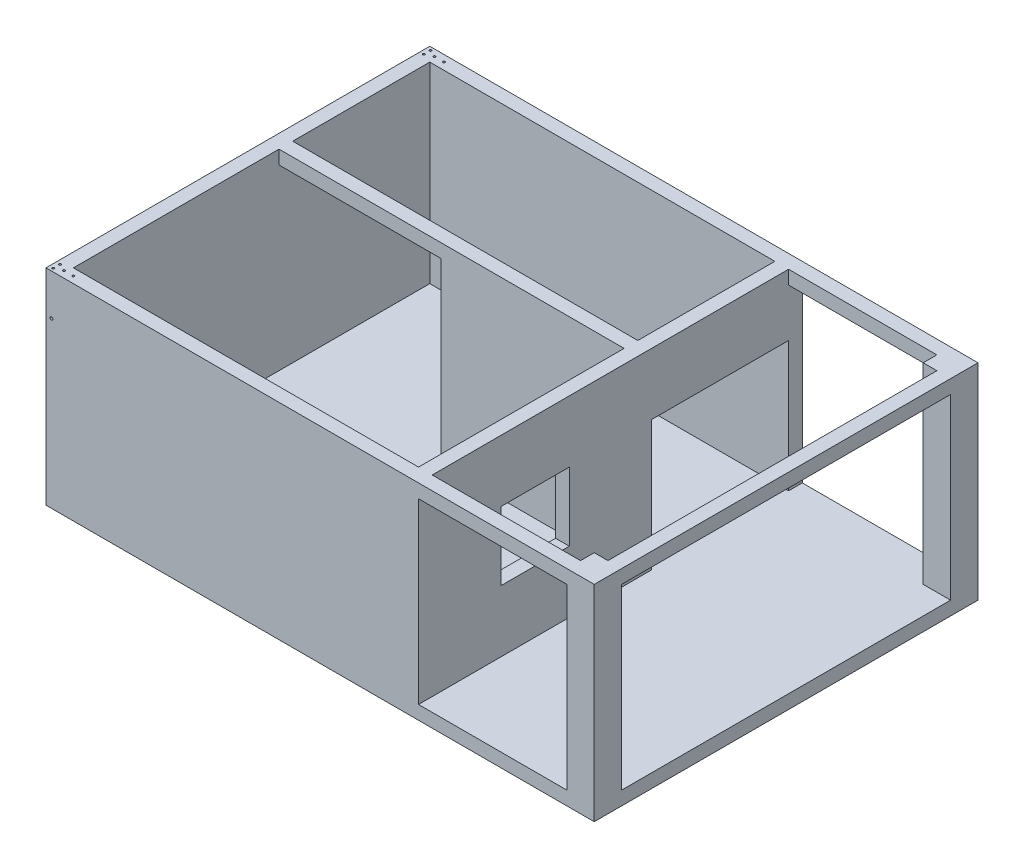
from build123d import *

# Parameters (mm, degrees)
SKETCH1_W               = 2000
SKETCH1_H               = 1400
BOSS_EXTRUDE1_DEPTH     = 50
SKETCH2_W               = 100
SKETCH2_H               = 100
SKETCH2_W_2             = 50
SKETCH2_H_2             = 1300
SKETCH2_W_3             = 718
SKETCH2_H_3             = 50
BOSS_EXTRUDE2_DEPTH     = 700
SKETCH3_W               = 50
SKETCH3_H               = 50
BOSS_EXTRUDE3_DEPTH     = 591
SKETCH4_W               = 50
SKETCH4_H               = 750
BOSS_EXTRUDE4_DEPTH     = 700
SKETCH5_W               = 250
SKETCH5_H               = 250
CUT_EXTRUDE1_DEPTH      = 700
SKETCH6_W               = 50
SKETCH6_H               = 225
BOSS_EXTRUDE5_DEPTH     = 500
SKETCH8_W               = 50
SKETCH8_H               = 50
BOSS_EXTRUDE6_DEPTH     = 541
SKETCH9_W               = 50
SKETCH9_H               = 50
BOSS_EXTRUDE7_DEPTH     = 1200
CUT_EXTRUDE3_DEPTH      = 2554.918557824
CUT_EXTRUDE3_DEPTH_BACK = 2554.918557824
SKETCH11_R              = 5
CUT_EXTRUDE4_DEPTH      = 2554.918557824
CUT_EXTRUDE4_DEPTH_BACK = 10
SKETCH12_R              = 4


with BuildPart() as part:
    # Sketch1 → Boss-Extrude1 (new body)
    with BuildSketch(Plane(origin=(0, 0, 0), x_dir=(1, 0, 0), z_dir=(0, 1, 0))):
        with Locations((1000, 700)):
            Rectangle(SKETCH1_W, SKETCH1_H)
    extrude(amount=BOSS_EXTRUDE1_DEPTH)

    # Sketch2 → Boss-Extrude2 (add)
    with BuildSketch(Plane(origin=(0, 50, 0), x_dir=(1, 0, 0), z_dir=(0, 1, 0))):
        with Locations((1950, 1350)):
            Rectangle(SKETCH2_W, SKETCH2_H)
        with Locations((1950, 50)):
            Rectangle(SKETCH2_W, SKETCH2_H)
        Polygon((0, 1400), (0, 1350), (50, 1350), (1359, 1350), (1359, 1400), align=None)
        with Locations((25, 700)):
            Rectangle(SKETCH2_W_2, SKETCH2_H_2)
        Polygon((50, 50), (0, 50), (0, 0), (1359, 0), (1359, 50), align=None)
        with Locations((1000, 825)):
            Rectangle(SKETCH2_W_3, SKETCH2_H_3)
    extrude(amount=BOSS_EXTRUDE2_DEPTH)

    # Sketch3 → Boss-Extrude3 (add)
    with BuildSketch(Plane.ZY.offset(-641)):
        with Locations((-825, 725)):
            Rectangle(SKETCH3_W, SKETCH3_H)
    extrude(amount=BOSS_EXTRUDE3_DEPTH)

    # Sketch4 → Boss-Extrude4 (add)
    with BuildSketch(Plane(origin=(0, 50, 0), x_dir=(1, 0, 0), z_dir=(0, 1, 0))):
        with Locations((1334, 425)):
            Rectangle(SKETCH4_W, SKETCH4_H)
    extrude(amount=BOSS_EXTRUDE4_DEPTH)

    # Sketch5 → Cut-Extrude1 (cut)
    with BuildSketch(Plane(origin=(1359, 0, 0), x_dir=(0, 0, -1), z_dir=(1, 0, 0))):
        with Locations((425, 400)):
            Rectangle(SKETCH5_W, SKETCH5_H)
    extrude(amount=-CUT_EXTRUDE1_DEPTH, mode=Mode.SUBTRACT)

    # Sketch6 → Boss-Extrude5 (add)
    with BuildSketch(Plane.XY.offset(-1350)):
        with Locations((1334, 637.5)):
            Rectangle(SKETCH6_W, SKETCH6_H)
    extrude(amount=BOSS_EXTRUDE5_DEPTH)

    # Sketch8 → Boss-Extrude6 (add)
    with BuildSketch(Plane(origin=(1359, 0, 0), x_dir=(0, 0, -1), z_dir=(1, 0, 0))):
        with Locations((25, 725)):
            Rectangle(SKETCH8_W, SKETCH8_H)
        with Locations((1375, 725)):
            Rectangle(SKETCH8_W, SKETCH8_H)
    extrude(amount=BOSS_EXTRUDE6_DEPTH)

    # Sketch9 → Boss-Extrude7 (add)
    with BuildSketch(Plane.XY.offset(-1300)):
        with Locations((1975, 725)):
            Rectangle(SKETCH9_W, SKETCH9_H)
    extrude(amount=BOSS_EXTRUDE7_DEPTH)

    # Sketch11 → Cut-Extrude3 (cut, two sides: drawn at the far end of the back side and taken through both)
    with BuildSketch(Plane.XY.offset(-CUT_EXTRUDE3_DEPTH_BACK)):
        with Locations((20, 600)):
            Circle(SKETCH11_R)
    extrude(amount=CUT_EXTRUDE3_DEPTH + CUT_EXTRUDE3_DEPTH_BACK, mode=Mode.SUBTRACT)

    # Sketch12 → Cut-Extrude4 (cut, two sides: drawn at the far end of the back side and taken through both)
    with BuildSketch(Plane(origin=(0, 750, 0), x_dir=(1, 0, 0), z_dir=(0, 1, 0)).offset(-CUT_EXTRUDE4_DEPTH_BACK)):
        with Locations(Location((14.5, 36, 0), (0, 0, 270))):
            Circle(SKETCH12_R)
        with Locations(Location((14.5, 12, 0), (0, 0, 270))):
            Circle(SKETCH12_R)
        with Locations(Location((41.5, 24, 0), (0, 0, 270))):
            Circle(SKETCH12_R)
        with Locations(Location((75.5, 24, 0), (0, 0, 270))):
            Circle(SKETCH12_R)
        with Locations(Location((14.5, 1388, 0), (0, 0, 270))):
            Circle(SKETCH12_R)
        with Locations(Location((14.5, 1364, 0), (0, 0, 270))):
            Circle(SKETCH12_R)
        with Locations(Location((41.5, 1376, 0), (0, 0, 270))):
            Circle(SKETCH12_R)
        with Locations(Location((75.5, 1376, 0), (0, 0, 270))):
            Circle(SKETCH12_R)
    extrude(amount=CUT_EXTRUDE4_DEPTH + CUT_EXTRUDE4_DEPTH_BACK, mode=Mode.SUBTRACT)


solid = part.part
